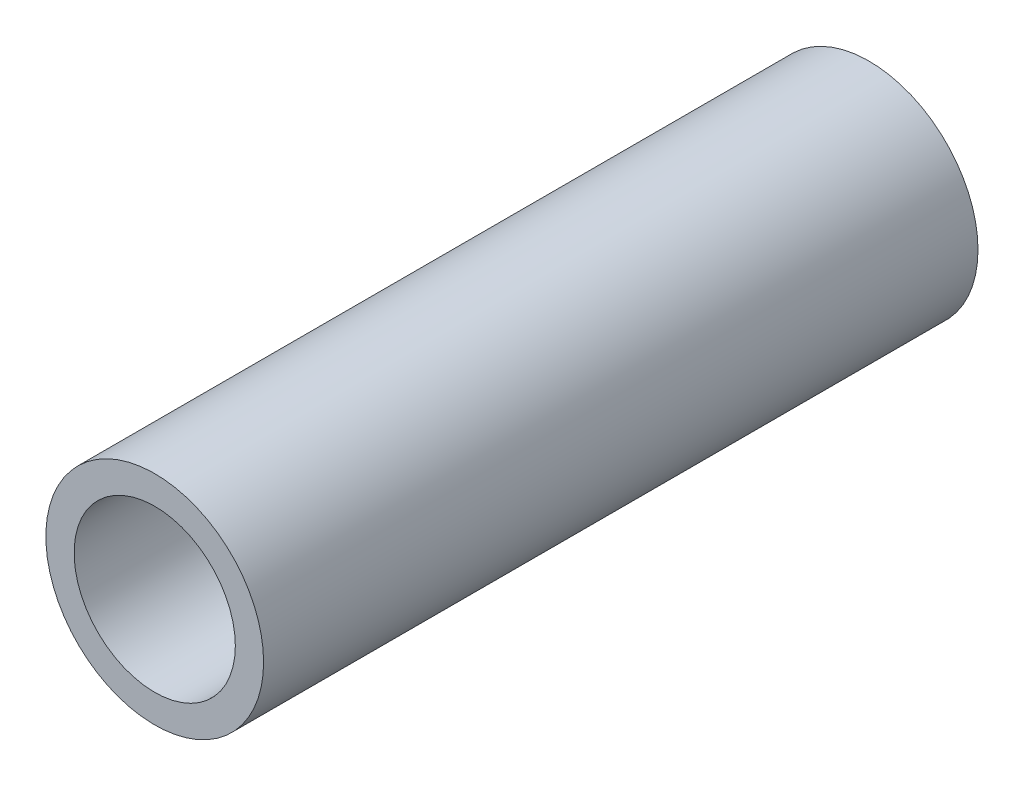
from build123d import *

# Parameters (mm, degrees)
SKETCH1_R           = 10.668
SKETCH1_R_2         = 7.8994
EXTRUDE_THIN1_DEPTH = 35


with BuildPart() as part:
    # Sketch1 → Extrude-Thin1 (new, symmetric)
    with BuildSketch(Plane.XY):
        Circle(SKETCH1_R)
        Circle(SKETCH1_R_2, mode=Mode.SUBTRACT)
    extrude(amount=EXTRUDE_THIN1_DEPTH, both=True)


solid = part.part
